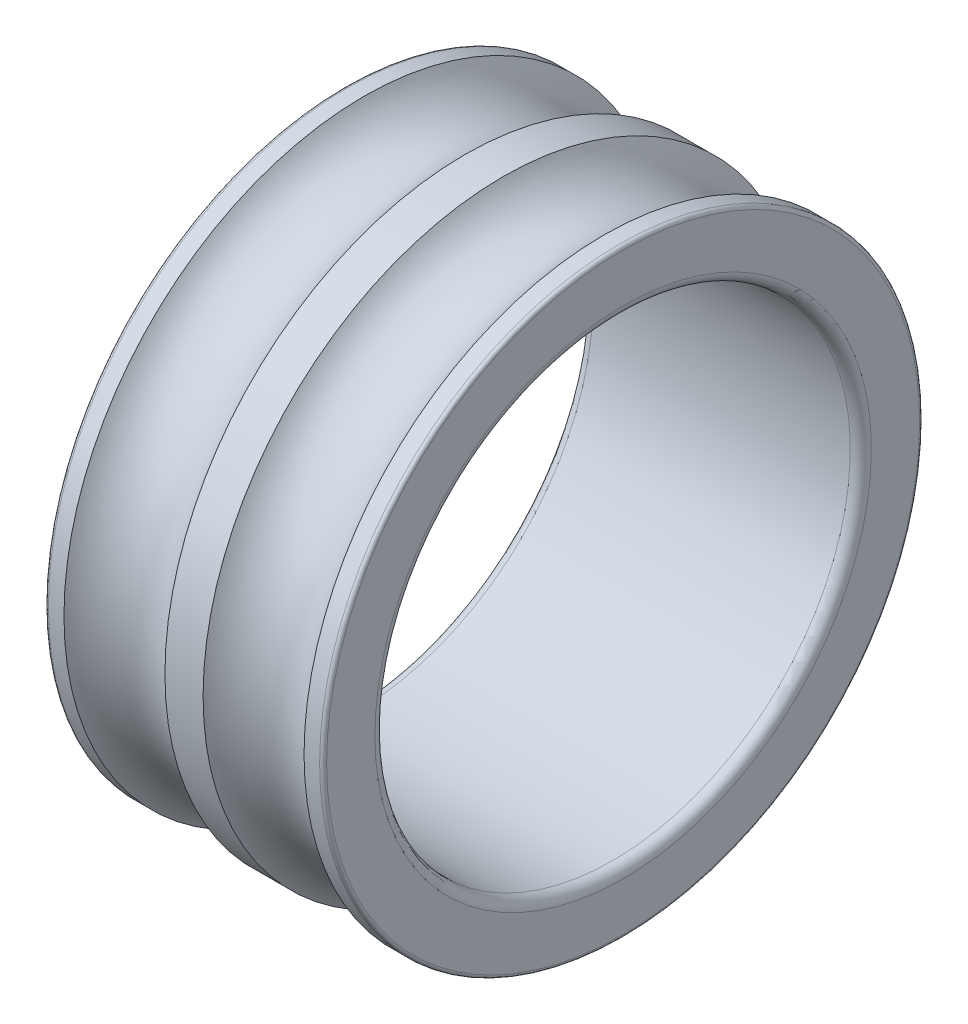
from build123d import *


with BuildPart() as part:
    # Schizzo1 → Rivoluzione1 (revolve)
    with BuildSketch(Plane.XY, mode=Mode.PRIVATE) as rivoluzione1_sk:
        with BuildLine():
            Line((2.1, 47.5), (53.5, 47.5))
            ThreePointArc((53.5, 47.5), (54.98492424, 48.11507576), (55.6, 49.6))
            Line((55.6, 49.6), (55.6, 59.25))
            ThreePointArc((55.6, 59.25), (55.394974747, 59.744974747), (54.9, 59.95))
            Line((54.9, 59.95), (51.786982254, 59.95))
            ThreePointArc((51.786982254, 59.95), (41.7, 54.369), (31.613017746, 59.95))
            Line((31.613017746, 59.95), (23.986982254, 59.95))
            ThreePointArc((23.986982254, 59.95), (13.9, 54.369), (3.813017746, 59.95))
            Line((3.813017746, 59.95), (0.7, 59.95))
            ThreePointArc((0.7, 59.95), (0.205025253, 59.744974747), (0, 59.25))
            Line((0, 59.25), (0, 49.6))
            ThreePointArc((0, 49.6), (0.61507576, 48.11507576), (2.1, 47.5))
        make_face()
    revolve(rivoluzione1_sk.sketch.rotate(Axis((55.6, 0, 0), (-1, 0, 0)), 270), axis=Axis((55.6, 0, 0), (-1, 0, 0)))


solid = part.part
